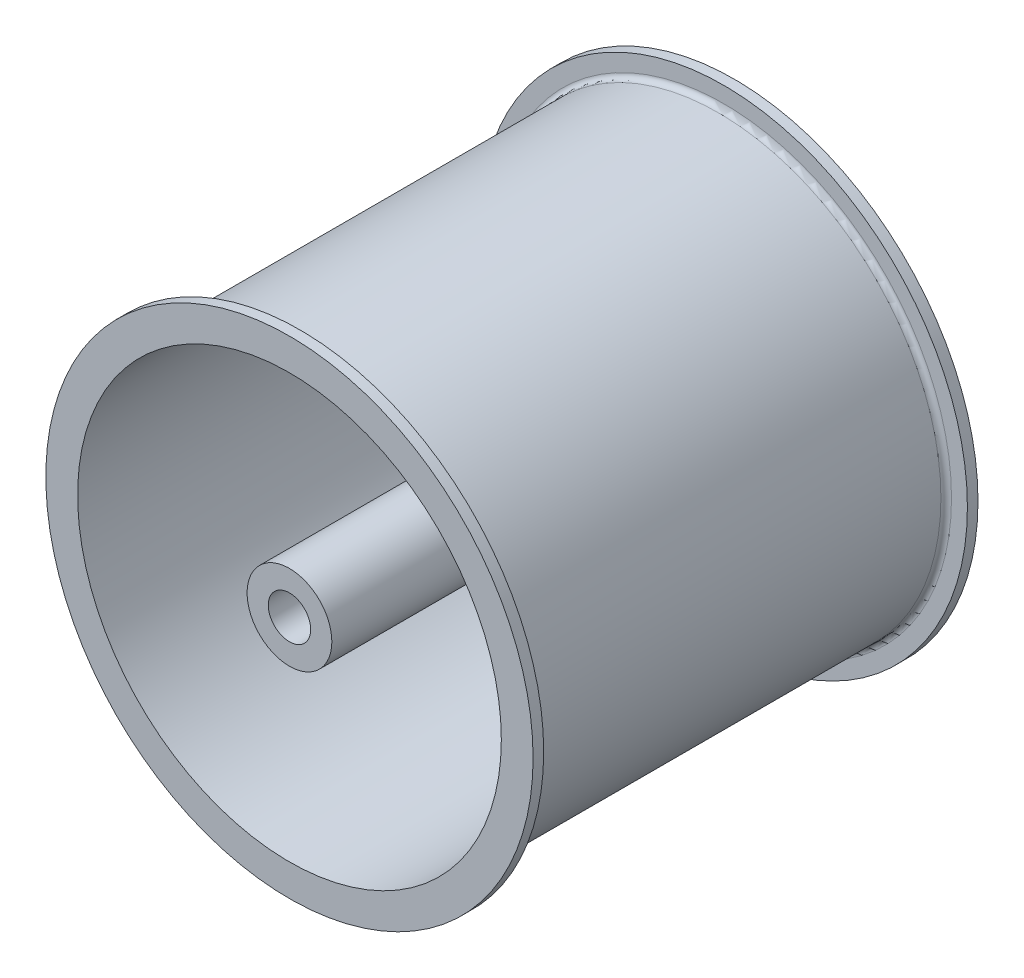
from build123d import *

# Parameters (mm, degrees)
SKETCH1_R            = 21
SKETCH1_R_2          = 20
EXTRUDE_THIN1_DEPTH  = 40
SKETCH2_R            = 23
SKETCH2_R_2          = 20
EXTRUDE_THIN2_DEPTH  = 1
FILLET1_R            = 0.5
FILLET1_OF_MIRROR1_R = 0.5
BOSS_EXTRUDE1_START  = 11
SKETCH3_R            = 20
BOSS_EXTRUDE1_DEPTH  = 1
SKETCH4_R            = 4
SKETCH4_R_2          = 3
EXTRUDE_THIN3_DEPTH  = 2
FILLET2_R            = 0.1
CUT_EXTRUDE1_REACH   = 46.249
SKETCH5_R            = 2
CUT_EXTRUDE2_REACH   = 46.249
SKETCH6_R            = 4
FILLET3_R            = 0.1
FILLET4_R            = 1
SKETCH7_R            = 4
SKETCH7_R_2          = 2
BOSS_EXTRUDE2_DEPTH  = 29
CHAMFER1_SIZE        = 3
FILLET5_R            = 0.001
SCALE1_SCALE         = 0.8


with BuildPart() as part:
    # Sketch1 → Extrude-Thin1 (new body)
    with BuildSketch(Plane.XY):
        Circle(SKETCH1_R)
        Circle(SKETCH1_R_2, mode=Mode.SUBTRACT)
    extrude(amount=EXTRUDE_THIN1_DEPTH)

    # Sketch2 → Extrude-Thin2 (add)
    with BuildSketch(Plane.XY.offset(40)):
        Circle(SKETCH2_R)
        Circle(SKETCH2_R_2, mode=Mode.SUBTRACT)
    extrude_thin2 = extrude(amount=EXTRUDE_THIN2_DEPTH)

    # Fillet1
    fillet1_edges = [part.edges().sort_by_distance(p)[0] for p in [
        (-21, 0, 40),
    ]]
    fillet(fillet1_edges, radius=FILLET1_R)

    # Mirror1: Extrude-Thin2 across plane
    add(extrude_thin2.mirror(Plane.XY.offset(20)))

    # Fillet1 of Mirror1
    fillet1_of_mirror1_edges = [part.edges().sort_by_distance(p)[0] for p in [
        (-21, 0, 0),
    ]]
    fillet(fillet1_of_mirror1_edges, radius=FILLET1_OF_MIRROR1_R)

    # Sketch3 → Boss-Extrude1 (add)
    with BuildSketch(Plane.XY.offset(BOSS_EXTRUDE1_START)):
        Circle(SKETCH3_R)
    extrude(amount=BOSS_EXTRUDE1_DEPTH)

    # Sketch4 → Extrude-Thin3 (add)
    with BuildSketch(Plane(origin=(0, 0, 11), x_dir=(-1, 0, 0), z_dir=(0, 0, -1))):
        Circle(SKETCH4_R)
        Circle(SKETCH4_R_2, mode=Mode.SUBTRACT)
    extrude(amount=EXTRUDE_THIN3_DEPTH)

    # Fillet2
    fillet2_edges = [part.edges().sort_by_distance(p)[0] for p in [
        (4, 0, 11),
        (4, 0, 9),
        (3, 0, 11),
        (3, 0, 9),
    ]]
    fillet(fillet2_edges, radius=FILLET2_R)

    # Sketch5 → Cut-Extrude1 (cut, up to next)
    with BuildSketch(Plane(origin=(0, 0, 11), x_dir=(-1, 0, 0), z_dir=(0, 0, -1)), mode=Mode.PRIVATE) as cut_extrude1_sk1:
        Circle(SKETCH5_R)
    cut_extrude1_tool1 = extrude(cut_extrude1_sk1.sketch, amount=-CUT_EXTRUDE1_REACH, mode=Mode.PRIVATE) & part.part
    add(cut_extrude1_tool1.solids().sort_by_distance((0, 0, 11))[0], mode=Mode.SUBTRACT)

    # Sketch6 → Cut-Extrude2 (cut, up to next)
    with BuildSketch(Plane(origin=(0, 0, 11), x_dir=(-1, 0, 0), z_dir=(0, 0, -1)), mode=Mode.PRIVATE) as cut_extrude2_sk1:
        with Locations((14, 0)):
            Circle(SKETCH6_R)
    cut_extrude2_tool1 = extrude(cut_extrude2_sk1.sketch, amount=-CUT_EXTRUDE2_REACH, mode=Mode.PRIVATE) & part.part
    # Sketch6 → Cut-Extrude2 (cut, up to next)
    with BuildSketch(Plane(origin=(0, 0, 11), x_dir=(-1, 0, 0), z_dir=(0, 0, -1)), mode=Mode.PRIVATE) as cut_extrude2_sk2:
        with Locations((9.899494937, 9.899494937)):
            Circle(SKETCH6_R)
    cut_extrude2_tool2 = extrude(cut_extrude2_sk2.sketch, amount=-CUT_EXTRUDE2_REACH, mode=Mode.PRIVATE) & part.part
    # Sketch6 → Cut-Extrude2 (cut, up to next)
    with BuildSketch(Plane(origin=(0, 0, 11), x_dir=(-1, 0, 0), z_dir=(0, 0, -1)), mode=Mode.PRIVATE) as cut_extrude2_sk3:
        with Locations((0, 14)):
            Circle(SKETCH6_R)
    cut_extrude2_tool3 = extrude(cut_extrude2_sk3.sketch, amount=-CUT_EXTRUDE2_REACH, mode=Mode.PRIVATE) & part.part
    # Sketch6 → Cut-Extrude2 (cut, up to next)
    with BuildSketch(Plane(origin=(0, 0, 11), x_dir=(-1, 0, 0), z_dir=(0, 0, -1)), mode=Mode.PRIVATE) as cut_extrude2_sk4:
        with Locations((-9.899494937, 9.899494937)):
            Circle(SKETCH6_R)
    cut_extrude2_tool4 = extrude(cut_extrude2_sk4.sketch, amount=-CUT_EXTRUDE2_REACH, mode=Mode.PRIVATE) & part.part
    # Sketch6 → Cut-Extrude2 (cut, up to next)
    with BuildSketch(Plane(origin=(0, 0, 11), x_dir=(-1, 0, 0), z_dir=(0, 0, -1)), mode=Mode.PRIVATE) as cut_extrude2_sk5:
        with Locations((-14, 0)):
            Circle(SKETCH6_R)
    cut_extrude2_tool5 = extrude(cut_extrude2_sk5.sketch, amount=-CUT_EXTRUDE2_REACH, mode=Mode.PRIVATE) & part.part
    # Sketch6 → Cut-Extrude2 (cut, up to next)
    with BuildSketch(Plane(origin=(0, 0, 11), x_dir=(-1, 0, 0), z_dir=(0, 0, -1)), mode=Mode.PRIVATE) as cut_extrude2_sk6:
        with Locations((-9.899494937, -9.899494937)):
            Circle(SKETCH6_R)
    cut_extrude2_tool6 = extrude(cut_extrude2_sk6.sketch, amount=-CUT_EXTRUDE2_REACH, mode=Mode.PRIVATE) & part.part
    # Sketch6 → Cut-Extrude2 (cut, up to next)
    with BuildSketch(Plane(origin=(0, 0, 11), x_dir=(-1, 0, 0), z_dir=(0, 0, -1)), mode=Mode.PRIVATE) as cut_extrude2_sk7:
        with Locations((0, -14)):
            Circle(SKETCH6_R)
    cut_extrude2_tool7 = extrude(cut_extrude2_sk7.sketch, amount=-CUT_EXTRUDE2_REACH, mode=Mode.PRIVATE) & part.part
    # Sketch6 → Cut-Extrude2 (cut, up to next)
    with BuildSketch(Plane(origin=(0, 0, 11), x_dir=(-1, 0, 0), z_dir=(0, 0, -1)), mode=Mode.PRIVATE) as cut_extrude2_sk8:
        with Locations((9.899494937, -9.899494937)):
            Circle(SKETCH6_R)
    cut_extrude2_tool8 = extrude(cut_extrude2_sk8.sketch, amount=-CUT_EXTRUDE2_REACH, mode=Mode.PRIVATE) & part.part
    add(cut_extrude2_tool1.solids().sort_by_distance((-14, 0, 11))[0], mode=Mode.SUBTRACT)
    add(cut_extrude2_tool2.solids().sort_by_distance((-9.899495, 9.899495, 11))[0], mode=Mode.SUBTRACT)
    add(cut_extrude2_tool3.solids().sort_by_distance((0, 14, 11))[0], mode=Mode.SUBTRACT)
    add(cut_extrude2_tool4.solids().sort_by_distance((9.899495, 9.899495, 11))[0], mode=Mode.SUBTRACT)
    add(cut_extrude2_tool5.solids().sort_by_distance((14, 0, 11))[0], mode=Mode.SUBTRACT)
    add(cut_extrude2_tool6.solids().sort_by_distance((9.899495, -9.899495, 11))[0], mode=Mode.SUBTRACT)
    add(cut_extrude2_tool7.solids().sort_by_distance((0, -14, 11))[0], mode=Mode.SUBTRACT)
    add(cut_extrude2_tool8.solids().sort_by_distance((-9.899495, -9.899495, 11))[0], mode=Mode.SUBTRACT)

    # Fillet3
    fillet3_edges = [part.edges().sort_by_distance(p)[0] for p in [
        (-10, 0, 12),
        (-10, 0, 11),
        (-5.899494937, 9.899494937, 12),
        (-5.899494937, 9.899494937, 11),
        (4, 14, 12),
        (4, 14, 11),
        (13.899494937, 9.899494937, 12),
        (13.899494937, 9.899494937, 11),
        (18, 0, 12),
        (18, 0, 11),
        (13.899494937, -9.899494937, 12),
        (13.899494937, -9.899494937, 11),
        (4, -14, 12),
        (4, -14, 11),
        (-5.899494937, -9.899494937, 12),
        (-5.899494937, -9.899494937, 11),
    ]]
    fillet(fillet3_edges, radius=FILLET3_R)

    # Fillet4
    fillet4_edges = [part.edges().sort_by_distance(p)[0] for p in [
        (-20, 0, 11),
    ]]
    fillet(fillet4_edges, radius=FILLET4_R)

    # Sketch7 → Boss-Extrude2 (add)
    with BuildSketch(Plane.XY.offset(12)):
        Circle(SKETCH7_R)
        with Locations(Location((0, 0, 0), (0, 0, 180))):
            Circle(SKETCH7_R_2, mode=Mode.SUBTRACT)
    extrude(amount=BOSS_EXTRUDE2_DEPTH)

    # Chamfer1
    chamfer1_edges = [part.edges().sort_by_distance(p)[0] for p in [
        (-4, 0, 12),
    ]]
    chamfer(chamfer1_edges, length=CHAMFER1_SIZE)

    # Fillet5
    fillet5_edges = [part.edges().sort_by_distance(p)[0] for p in [
        (-4, 0, 15),
        (-7, 0, 12),
    ]]
    fillet(fillet5_edges, radius=FILLET5_R)


with BuildPart() as part_1:
    # Scale1: scaled about (0, 0, 19.787626946)
    add(part.part.scale(SCALE1_SCALE).moved(Location((0, 0, 3.957525389))))


solid = part_1.part
